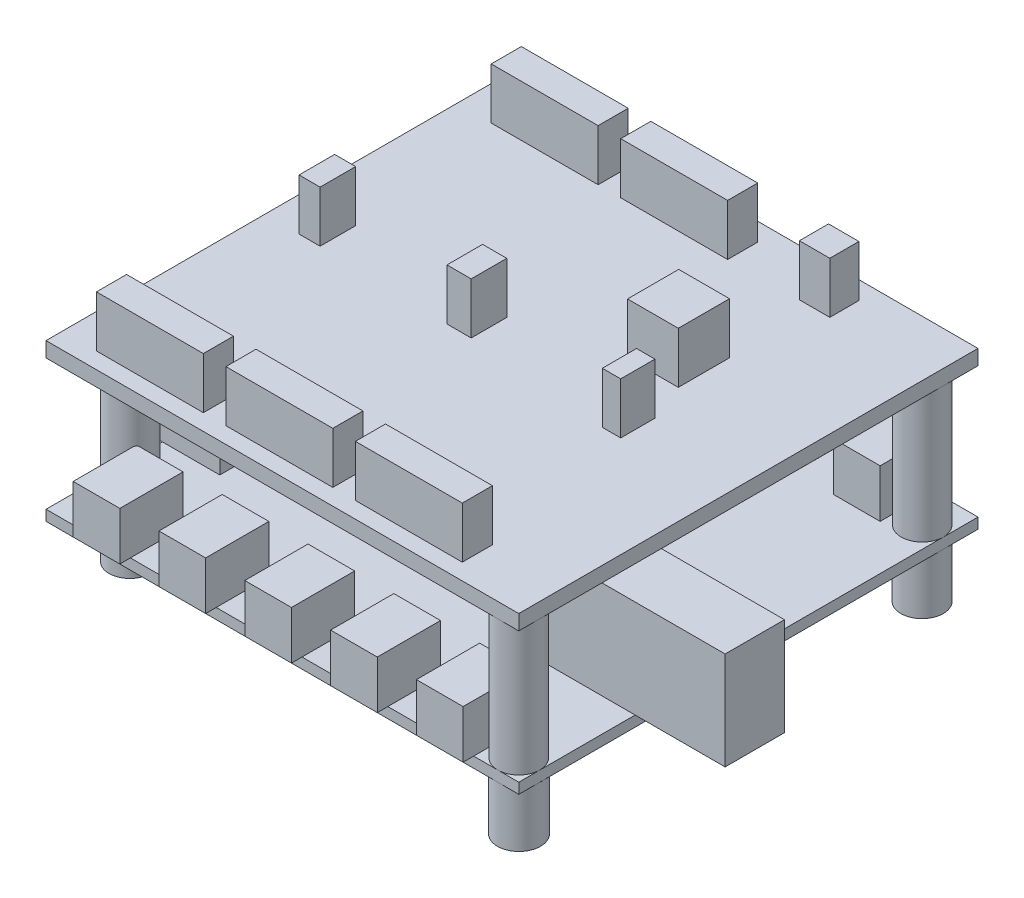
from build123d import *

# Parameters (mm, degrees)
SKETCH1_W            = 79.756
SKETCH1_H            = 77.47
BOSS_EXTRUDE1_DEPTH  = 2.54
SKETCH5_R            = 3.556
BOSS_EXTRUDE2_DEPTH  = 22.098
SKETCH6_R            = 3.556
BOSS_EXTRUDE3_DEPTH  = 22.098
SKETCH7_R            = 3.556
BOSS_EXTRUDE4_DEPTH  = 22.098
SKETCH8_R            = 3.556
BOSS_EXTRUDE5_DEPTH  = 22.098
SKETCH9_W            = 79.756
SKETCH9_H            = 77.47
BOSS_EXTRUDE6_DEPTH  = 1.778
SKETCH13_R           = 3.572453585
BOSS_EXTRUDE8_DEPTH  = 9.398
SKETCH14_R           = 3.581807536
BOSS_EXTRUDE9_DEPTH  = 9.398
SKETCH15_R           = 3.531867283
BOSS_EXTRUDE10_DEPTH = 9.398
SKETCH16_R           = 3.638996418
BOSS_EXTRUDE11_DEPTH = 9.398
SKETCH17_W           = 18.034
SKETCH17_H           = 5.08
SKETCH17_W_2         = 8.568802466
SKETCH17_H_2         = 8.638625552
SKETCH17_W_3         = 5.128240349
SKETCH17_H_3         = 4.912572661
SKETCH17_W_4         = 3.098956307
SKETCH17_H_4         = 5.766362671
SKETCH17_W_5         = 4.079015947
SKETCH17_H_5         = 6.003920612
SKETCH17_W_6         = 3.549400995
BOSS_EXTRUDE12_DEPTH = 8.636
BOSS_EXTRUDE13_DEPTH = 8.128
SKETCH19_W           = 11.43
SKETCH19_H           = 7.62
BOSS_EXTRUDE14_DEPTH = 8.128
SKETCH20_W           = 30.384259677
SKETCH20_H           = 10.014671369
BOSS_EXTRUDE15_DEPTH = 16.51


with BuildPart() as part:
    # Sketch1 → Boss-Extrude1 (new body)
    with BuildSketch(Plane(origin=(0, 0, 0), x_dir=(1, 0, 0), z_dir=(0, 1, 0))):
        Rectangle(SKETCH1_W, SKETCH1_H)
    extrude(amount=BOSS_EXTRUDE1_DEPTH)

    # Sketch5 → Boss-Extrude2 (add)
    with BuildSketch(Plane.XZ):
        with Locations((36.322, 35.179)):
            Circle(SKETCH5_R)
    extrude(amount=BOSS_EXTRUDE2_DEPTH)

    # Sketch6 → Boss-Extrude3 (add)
    with BuildSketch(Plane.XZ):
        with Locations((36.322, -32.893)):
            Circle(SKETCH6_R)
    extrude(amount=BOSS_EXTRUDE3_DEPTH)

    # Sketch7 → Boss-Extrude4 (add)
    with BuildSketch(Plane.XZ):
        with Locations((-36.322, 28.067)):
            Circle(SKETCH7_R)
    extrude(amount=BOSS_EXTRUDE4_DEPTH)

    # Sketch8 → Boss-Extrude5 (add)
    with BuildSketch(Plane.XZ):
        with Locations((-36.322, -28.067)):
            Circle(SKETCH8_R)
    extrude(amount=BOSS_EXTRUDE5_DEPTH)

    # Sketch9 → Boss-Extrude6 (add)
    with BuildSketch(Plane.XZ.offset(22.098)):
        with Locations((0.00687462, 0)):
            Rectangle(SKETCH9_W, SKETCH9_H)
    extrude(amount=BOSS_EXTRUDE6_DEPTH)

    # Sketch13 → Boss-Extrude8 (add)
    with BuildSketch(Plane.XZ.offset(23.876)):
        with Locations((-36.298671795, -28.057552782)):
            Circle(SKETCH13_R)
    extrude(amount=BOSS_EXTRUDE8_DEPTH)

    # Sketch14 → Boss-Extrude9 (add)
    with BuildSketch(Plane(origin=(0, -23.876, 0), x_dir=(-1, 0, 0), z_dir=(0, -1, 0))):
        with Locations((-36.303067084, 32.884206209)):
            Circle(SKETCH14_R)
    extrude(amount=BOSS_EXTRUDE9_DEPTH)

    # Sketch15 → Boss-Extrude10 (add)
    with BuildSketch(Plane.XZ.offset(23.876)):
        with Locations((-36.339258097, 28.098249402)):
            Circle(SKETCH15_R)
    extrude(amount=BOSS_EXTRUDE10_DEPTH)

    # Sketch16 → Boss-Extrude11 (add)
    with BuildSketch(Plane.XZ.offset(23.876)):
        with Locations((36.279655864, 35.096003582)):
            Circle(SKETCH16_R)
    extrude(amount=BOSS_EXTRUDE11_DEPTH)

    # Sketch17 → Boss-Extrude12 (add)
    with BuildSketch(Plane(origin=(0, 2.54, 0), x_dir=(1, 0, 0), z_dir=(0, 1, 0))):
        with Locations((-25.091141252, 33.147)):
            Rectangle(SKETCH17_W, SKETCH17_H)
        with Locations((-3.247141252, 33.147)):
            Rectangle(SKETCH17_W, SKETCH17_H)
        with Locations((-25.091141252, -33.454815331)):
            Rectangle(SKETCH17_W, SKETCH17_H)
        with Locations((-3.247141252, -33.454815331)):
            Rectangle(SKETCH17_W, SKETCH17_H)
        with Locations((18.596858748, -33.454815331)):
            Rectangle(SKETCH17_W, SKETCH17_H)
        with Locations((16.009585597, 12.083689686)):
            Rectangle(SKETCH17_W_2, SKETCH17_H_2)
        with Locations((20.28077831, 33.23071367)):
            Rectangle(SKETCH17_W_3, SKETCH17_H_3)
        with Locations((21.276937926, -1.599835358)):
            Rectangle(SKETCH17_W_4, SKETCH17_H_4)
        with Locations((-6.434192273, 0.512126633)):
            Rectangle(SKETCH17_W_5, SKETCH17_H_5)
        with Locations((-32.321334256, 1.175103028)):
            Rectangle(SKETCH17_W_6, SKETCH17_H_5)
    extrude(amount=BOSS_EXTRUDE12_DEPTH)

    # Sketch18 → Boss-Extrude13 (add)
    with BuildSketch(Plane(origin=(0, -22.098, 0), x_dir=(1, 0, 0), z_dir=(0, 1, 0))):
        Polygon((32.26487462, 38.735), (32.26487462, 29.845), (24.39087462, 29.845), (24.39087462, 38.735), (24.39087462, 40.513), (32.26487462, 40.513), align=None)
        Polygon((17.78687462, 38.735), (17.78687462, 29.845), (9.91287462, 29.845), (9.91287462, 38.735), (9.91287462, 40.513), (17.78687462, 40.513), align=None)
        Polygon((3.30887462, 38.735), (3.30887462, 29.845), (-4.56512538, 29.845), (-4.56512538, 38.735), (-4.56512538, 40.513), (3.30887462, 40.513), align=None)
        Polygon((-11.16912538, 38.735), (-11.16912538, 29.845), (-19.04312538, 29.845), (-19.04312538, 38.735), (-19.04312538, 40.513), (-11.16912538, 40.513), align=None)
        Polygon((-25.64712538, 38.735), (-25.64712538, 29.845), (-33.52112538, 29.845), (-33.52112538, 38.735), (-33.52112538, 40.513), (-25.64712538, 40.513), align=None)
    boss_extrude13 = extrude(amount=BOSS_EXTRUDE13_DEPTH)

    # Mirror1: Boss-Extrude13 across plane
    add(boss_extrude13.mirror(Plane.XY))

    # Sketch19 → Boss-Extrude14 (add)
    with BuildSketch(Plane(origin=(0, -22.098, 0), x_dir=(1, 0, 0), z_dir=(0, 1, 0))):
        with Locations((-35.93412538, 18.880128505)):
            Rectangle(SKETCH19_W, SKETCH19_H)
        with Locations((-35.93412538, 3.008088648)):
            Rectangle(SKETCH19_W, SKETCH19_H)
        with Locations((-35.93412538, -15.265568035)):
            Rectangle(SKETCH19_W, SKETCH19_H)
    extrude(amount=BOSS_EXTRUDE14_DEPTH)

    # Sketch20 → Boss-Extrude15 (add)
    with BuildSketch(Plane(origin=(0, -22.098, 0), x_dir=(1, 0, 0), z_dir=(0, 1, 0))):
        with Locations((39.873999471, -14.101031432)):
            Rectangle(SKETCH20_W, SKETCH20_H)
    extrude(amount=BOSS_EXTRUDE15_DEPTH)


solid = part.part
